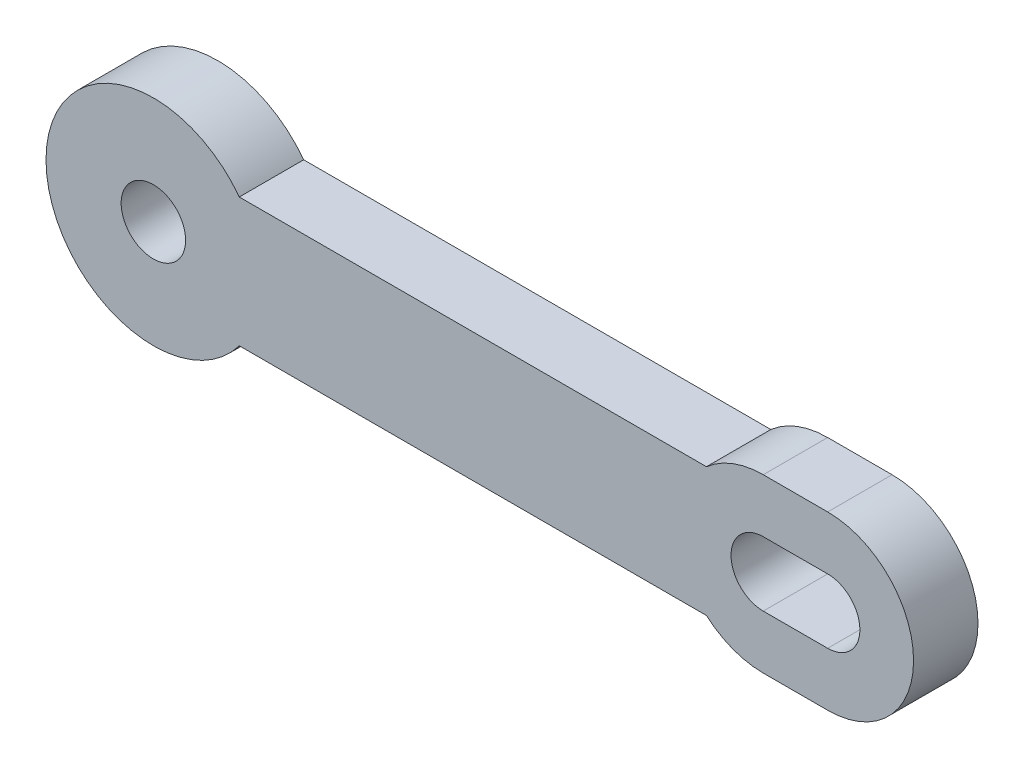
from build123d import *

# Parameters (mm, degrees)
SALIENTE_EXTRUIR2_DEPTH = 3


with BuildPart() as part:
    # Croquis1 → Saliente-Extruir2 (new body)
    # profile 1 of 6: a face of its own
    with BuildSketch(Plane.XY):
        with BuildLine():
            Line((0, -1.5), (0, -3))
            Line((0, -3), (4, -3))
            ThreePointArc((4, -3), (4.74341649, -1.58113883), (5, 0))
            ThreePointArc((5, 0), (4.74341649, 1.58113883), (4, 3))
            Line((4, 3), (0, 3))
            Line((0, 3), (0, 1.5))
            ThreePointArc((0, 1.5), (1.060660172, 1.060660172), (1.5, 0))
            ThreePointArc((1.5, 0), (1.060660172, -1.060660172), (0, -1.5))
        make_face()
    # profile 2 of 6: a face of its own
    with BuildSketch(Plane.XY):
        with BuildLine():
            Line((4, -3), (0, -3))
            Line((0, -3), (0, -1.5))
            ThreePointArc((0, -1.5), (-1.5, 0), (0, 1.5))
            Line((0, 1.5), (0, 3))
            Line((0, 3), (4, 3))
            ThreePointArc((4, 3), (-5, 0), (4, -3))
        make_face()
    # profile 3 of 6: a face of its own
    with BuildSketch(Plane.XY):
        with BuildLine():
            Line((0, -1.5), (0, -3))
            Line((0, -3), (4, -3))
            ThreePointArc((4, -3), (4.74341649, -1.58113883), (5, 0))
            ThreePointArc((5, 0), (4.74341649, 1.58113883), (4, 3))
            Line((4, 3), (0, 3))
            Line((0, 3), (0, 1.5))
            ThreePointArc((0, 1.5), (1.060660172, 1.060660172), (1.5, 0))
            ThreePointArc((1.5, 0), (1.060660172, -1.060660172), (0, -1.5))
        make_face()
    # profile 4 of 6: a face of its own
    with BuildSketch(Plane.XY):
        with BuildLine():
            Line((4, -3), (0, -3))
            Line((0, -3), (0, -1.5))
            ThreePointArc((0, -1.5), (-1.5, 0), (0, 1.5))
            Line((0, 1.5), (0, 3))
            Line((0, 3), (4, 3))
            ThreePointArc((4, 3), (-5, 0), (4, -3))
        make_face()
    # profile 5 of 6: a face of its own
    with BuildSketch(Plane.XY):
        with BuildLine():
            ThreePointArc((5, 0), (4.74341649, -1.58113883), (4, -3))
            Line((4, -3), (25.754248689, -3))
            ThreePointArc((25.754248689, -3), (24.4, 0), (25.754248689, 3))
            Line((25.754248689, 3), (4, 3))
            ThreePointArc((4, 3), (4.74341649, 1.58113883), (5, 0))
        make_face()
    # profile 6 of 6: a face of its own
    with BuildSketch(Plane.XY):
        with BuildLine():
            ThreePointArc((25.754248689, 3), (24.4, 0), (25.754248689, -3))
            ThreePointArc((25.754248689, -3), (26.985786438, -3.741657387), (28.4, -4))
            Line((28.4, -4), (31.4, -4))
            ThreePointArc((31.4, -4), (35.4, 0), (31.4, 4))
            Line((31.4, 4), (28.4, 4))
            ThreePointArc((28.4, 4), (26.985786438, 3.741657387), (25.754248689, 3))
        make_face()
        with BuildLine():
            Line((31.4, -1.5), (28.4, -1.5))
            ThreePointArc((28.4, -1.5), (26.9, 0), (28.4, 1.5))
            Line((28.4, 1.5), (31.4, 1.5))
            ThreePointArc((31.4, 1.5), (32.460660172, 1.060660172), (32.9, 0))
            ThreePointArc((32.9, 0), (32.460660172, -1.060660172), (31.4, -1.5))
        make_face(mode=Mode.SUBTRACT)
    extrude(amount=SALIENTE_EXTRUIR2_DEPTH)


solid = part.part
